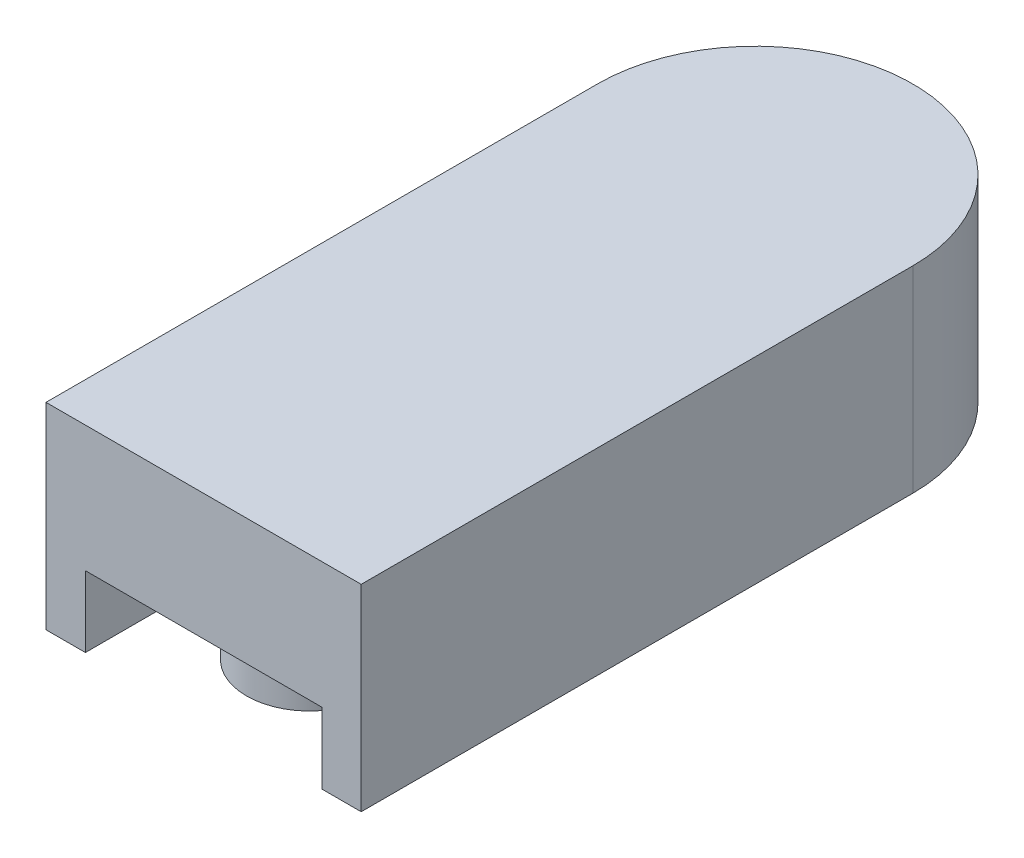
from build123d import *

# Parameters (mm, degrees)
RESSALTO_EXTRUS_O1_DEPTH = 25
ESBO_O2_R                = 8
CORTE_EXTRUS_O2_DEPTH    = 9


with BuildPart() as part:
    # Esboço1 → Ressalto-extrusão1 (new body)
    with BuildSketch(Plane(origin=(0, 0, 0), x_dir=(1, 0, 0), z_dir=(0, 1, 0))):
        Polygon((-17.666653224, -22.560793644), (-17.666653224, 0), (-17.666653224, 47.439206356), (2.333346776, 47.439206356), (22.333346776, 47.439206356), (22.333346776, 0), (22.333346776, -22.560793644), (2.333346776, -22.560793644), align=None)
        with BuildLine():
            ThreePointArc((2.333346776, 67.439206356), (16.4754824, 61.581341979), (22.333346776, 47.439206356))
            Line((22.333346776, 47.439206356), (2.333346776, 47.439206356))
            Line((2.333346776, 47.439206356), (2.333346776, 67.439206356))
        make_face()
        with BuildLine():
            Line((2.333346776, 47.439206356), (2.333346776, 67.439206356))
            ThreePointArc((2.333346776, 67.439206356), (-11.808788848, 61.581341979), (-17.666653224, 47.439206356))
            Line((-17.666653224, 47.439206356), (2.333346776, 47.439206356))
        make_face()
    extrude(amount=RESSALTO_EXTRUS_O1_DEPTH)

    # Esboço2 → Corte-extrusão2 (cut)
    with BuildSketch(Plane(origin=(0, 0, 0), x_dir=(1, 0, 0), z_dir=(0, 1, 0))):
        with BuildLine():
            Line((-12.666653224, -22.560793644), (-12.666653224, -9.110478183))
            ThreePointArc((-12.666653224, -9.110478183), (2.333346776, 5.889521817), (17.333346776, -9.110478183))
            Line((17.333346776, -9.110478183), (17.333346776, -22.560793644))
            Line((17.333346776, -22.560793644), (-12.666653224, -22.560793644))
        make_face()
        with Locations(Location((2.333346776, -9.110478183, 0), (0, 0, 270))):
            Circle(ESBO_O2_R, mode=Mode.SUBTRACT)
    extrude(amount=CORTE_EXTRUS_O2_DEPTH, mode=Mode.SUBTRACT)


solid = part.part
